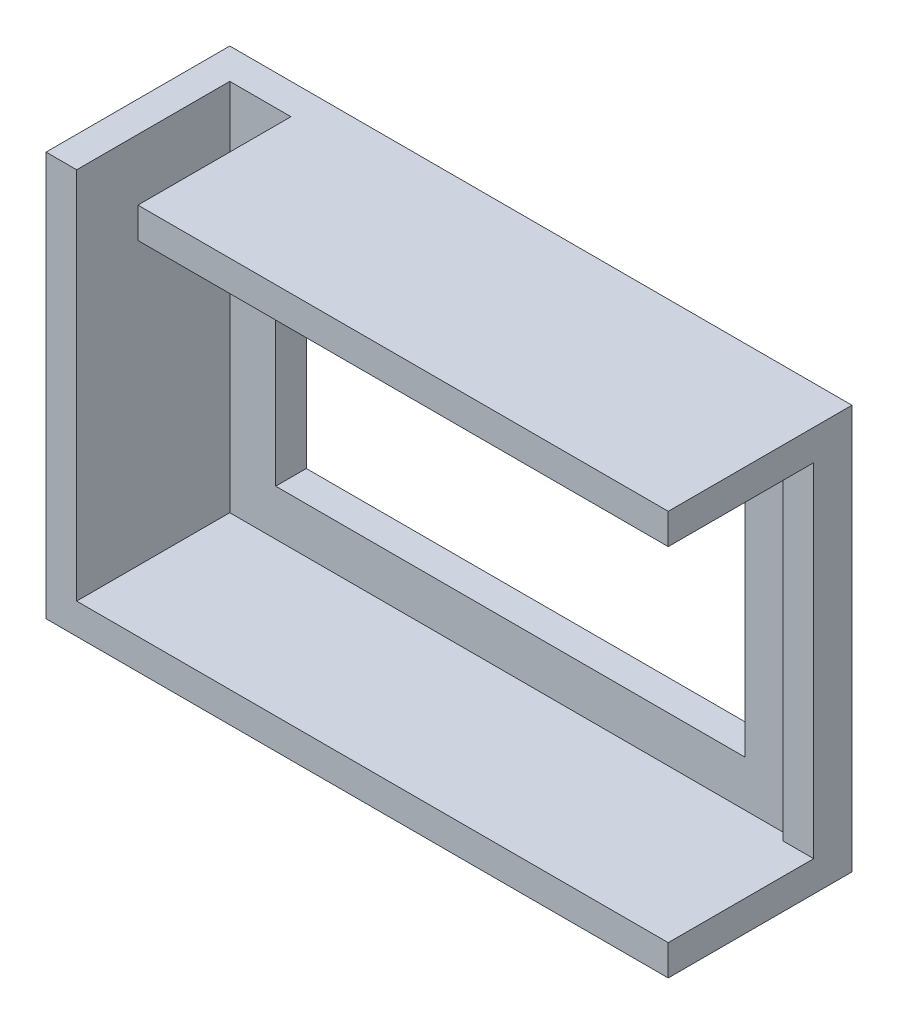
from build123d import *

# Parameters (mm, degrees)
ESQUISSE1_W             = 20.32
ESQUISSE1_H             = 13.2
BOSS_EXTRU_1_DEPTH      = 6
ESQUISSE2_W             = 18.32
ESQUISSE2_H             = 11.2
ENL_V_MAT_EXTRU_1_DEPTH = 5
ESQUISSE3_W             = 2
ESQUISSE3_H             = 1
ENL_V_MAT_EXTRU_2_DEPTH = 5
ESQUISSE4_W             = 15.32
ESQUISSE4_H             = 8.2
ENL_V_MAT_EXTRU_3_DEPTH = 25.741511676
ESQUISSE6_W             = 1
ESQUISSE6_H             = 11.2
ENL_V_MAT_EXTRU_4_DEPTH = 4.75


with BuildPart() as part:
    # Esquisse1 → Boss.-Extru.1 (new body)
    with BuildSketch(Plane.XY):
        with Locations((10.16, 6.6)):
            Rectangle(ESQUISSE1_W, ESQUISSE1_H)
    extrude(amount=BOSS_EXTRU_1_DEPTH)

    # Esquisse2 → Enlèv. mat.-Extru.1 (cut)
    with BuildSketch(Plane.XY.offset(6)):
        with Locations((10.16, 6.6)):
            Rectangle(ESQUISSE2_W, ESQUISSE2_H)
    extrude(amount=-ENL_V_MAT_EXTRU_1_DEPTH, mode=Mode.SUBTRACT)

    # Esquisse3 → Enlèv. mat.-Extru.2 (cut)
    with BuildSketch(Plane.XY.offset(6)):
        with Locations((2, 12.7)):
            Rectangle(ESQUISSE3_W, ESQUISSE3_H)
    extrude(amount=-ENL_V_MAT_EXTRU_2_DEPTH, mode=Mode.SUBTRACT)

    # Esquisse4 → Enlèv. mat.-Extru.3 (cut, through all)
    with BuildSketch(Plane.XY.offset(1)):
        with Locations((10.16, 6.6)):
            Rectangle(ESQUISSE4_W, ESQUISSE4_H)
    extrude(amount=-ENL_V_MAT_EXTRU_3_DEPTH, mode=Mode.SUBTRACT)

    # Esquisse6 → Enlèv. mat.-Extru.4 (cut)
    with BuildSketch(Plane.XY.offset(6)):
        with Locations((19.82, 6.6)):
            Rectangle(ESQUISSE6_W, ESQUISSE6_H)
    extrude(amount=-ENL_V_MAT_EXTRU_4_DEPTH, mode=Mode.SUBTRACT)


solid = part.part
